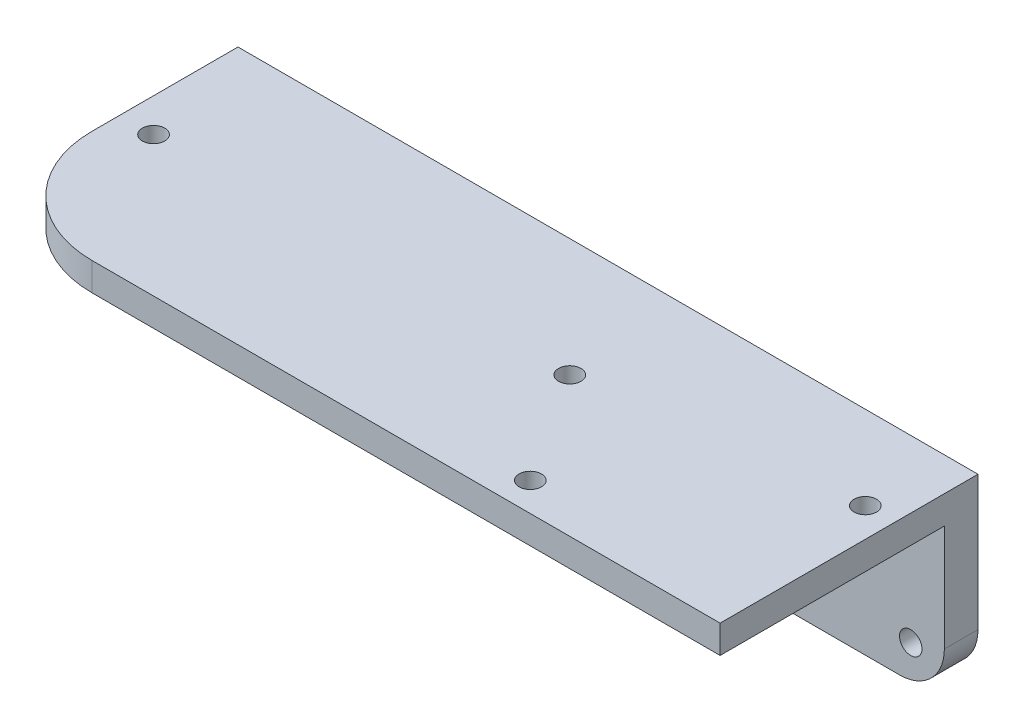
from build123d import *

# Parameters (mm, degrees)
ESBO_O21_W               = 66
ESBO_O21_H               = 16
RESSALTO_EXTRUS_O1_DEPTH = 3
ESBO_O22_W               = 66
ESBO_O22_H               = 2.5
RESSALTO_EXTRUS_O2_DEPTH = 20
ESBO_O23_R               = 1
CORTE_EXTRUS_O9_DEPTH    = 43.429353047
ESBO_O24_R               = 1
ESBO_O24_W               = 8
ESBO_O24_H               = 10
CORTE_EXTRUS_O10_DEPTH   = 40.40812099
FILETE1_R                = 10
FILETE2_R                = 4
FILETE3_R                = 1


with BuildPart() as part:
    # Esboço21 → Ressalto-extrusão1 (new body)
    with BuildSketch(Plane.XY):
        Rectangle(ESBO_O21_W, ESBO_O21_H)
    extrude(amount=RESSALTO_EXTRUS_O1_DEPTH)

    # Esboço22 → Ressalto-extrusão2 (add)
    with BuildSketch(Plane.XY.offset(3)):
        with Locations((0, 6.75)):
            Rectangle(ESBO_O22_W, ESBO_O22_H)
    extrude(amount=RESSALTO_EXTRUS_O2_DEPTH)

    # Esboço23 → Corte-extrusão9 (cut, through all)
    with BuildSketch(Plane.XZ.offset(-5.5)):
        with Locations(Location((-30, 10.53, 0), (0, 0, 270))):
            Circle(ESBO_O23_R)
        with Locations(Location((7.12, 10.53, 0), (0, 0, 270))):
            Circle(ESBO_O23_R)
        with Locations(Location((30.4, 7.45, 0), (0, 0, 270))):
            Circle(ESBO_O23_R)
        with Locations(Location((13.51, 20.44, 0), (0, 0, 270))):
            Circle(ESBO_O23_R)
    extrude(amount=-CORTE_EXTRUS_O9_DEPTH, mode=Mode.SUBTRACT)

    # Esboço24 → Corte-extrusão10 (cut, through all)
    with BuildSketch(Plane.XY.offset(3)):
        with Locations((-30, -5)):
            Circle(ESBO_O24_R)
        with Locations((-12.27, 0)):
            Rectangle(ESBO_O24_W, ESBO_O24_H)
    corte_extrus_o10 = extrude(amount=-CORTE_EXTRUS_O10_DEPTH, mode=Mode.SUBTRACT)

    # Filete1
    filete1_edges = [part.edges().sort_by_distance(p)[0] for p in [
        (-33, 6.75, 23),
    ]]
    fillet(filete1_edges, radius=FILETE1_R)

    # Filete2
    filete2_edges = [part.edges().sort_by_distance(p)[0] for p in [
        (33, -8, 1.5),
        (-33, -8, 1.5),
    ]]
    fillet(filete2_edges, radius=FILETE2_R)

    # Espelhar1: Corte-extrusão10 across plane
    add(corte_extrus_o10.mirror(Plane(origin=(0, 0, 0), x_dir=(0, 0, 1), z_dir=(1, 0, 0))), mode=Mode.SUBTRACT)

    # Filete3
    filete3_edges = [part.edges().sort_by_distance(p)[0] for p in [
        (-8.27, 5, 1.5),
        (-8.27, -5, 1.5),
        (-16.27, -5, 1.5),
        (-16.27, 5, 1.5),
        (8.27, -5, 1.5),
        (8.27, 5, 1.5),
        (16.27, 5, 1.5),
        (16.27, -5, 1.5),
    ]]
    fillet(filete3_edges, radius=FILETE3_R)


solid = part.part
